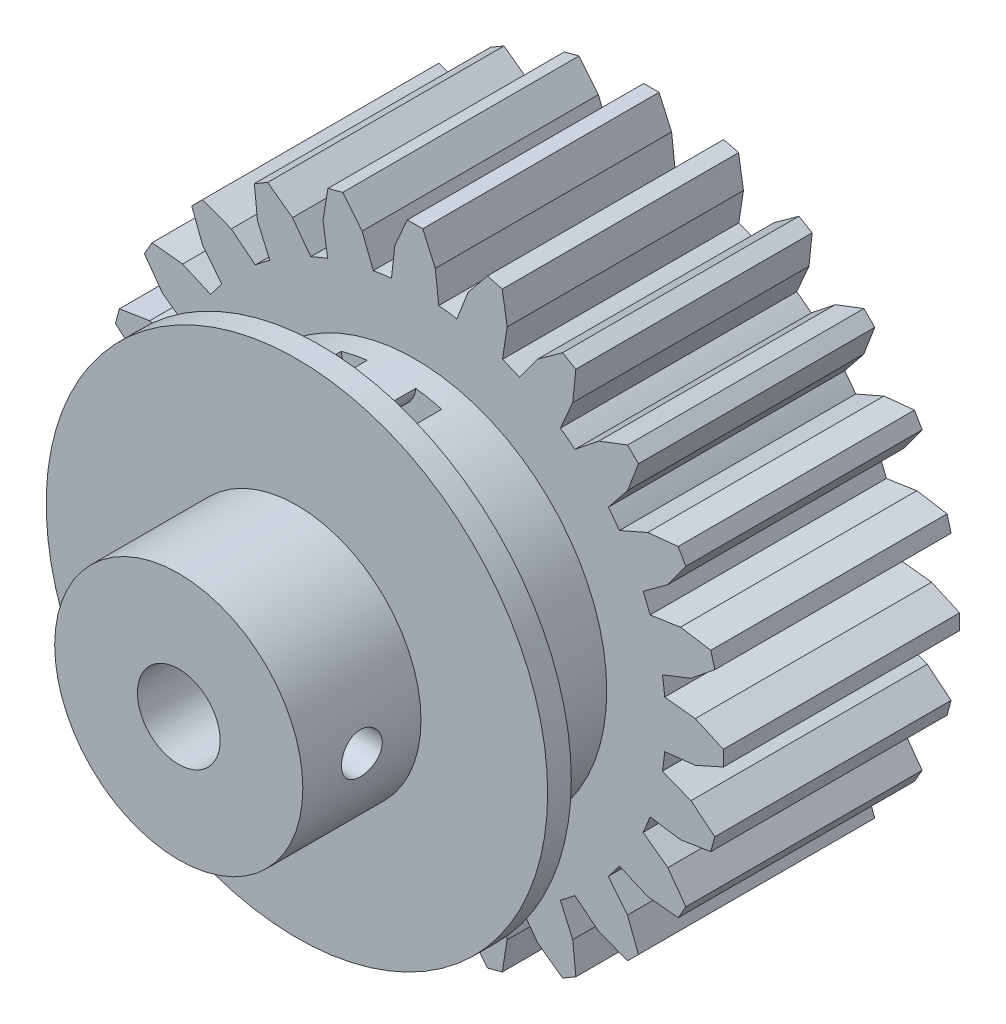
from build123d import *

# Parameters (mm, degrees)
ESQUISSE1_R                  = 3.5
BOSS_EXTRU_1_DEPTH           = 20
ESQUISSE2_R                  = 16.22
ESQUISSE2_R_2                = 3.5
BOSS_EXTRU_2_DEPTH           = 10
ESQUISSE14_R                 = 10.5
ESQUISSE14_R_2               = 3.5
BOSS_EXTRU_9_DEPTH           = 10
BOSS_EXTRU_10_START          = -2
ESQUISSE15_R                 = 21.22
ESQUISSE15_R_2               = 16.22
BOSS_EXTRU_10_DEPTH          = 2
ENL_V_MAT_EXTRU_1_REACH      = 56.412
ENL_V_MAT_EXTRU_1_END_RADIUS = 10.5
ESQUISSE3_R                  = 1.725
ENL_V_START                  = 2
ENL_V_MAT_EXTRU_2_DEPTH      = 4


with BuildPart() as part:
    # Esquisse1 → Boss.-Extru.1 (new body)
    with BuildSketch(Plane.XY):
        with BuildLine():
            Line((-2, 21.125539046), (-1.710180776, 23.709335636))
            Line((-1.710180776, 23.709335636), (-0.65, 26.083365274))
            Line((-0.65, 26.083365274), (0.65, 26.083365274))
            Line((0.65, 26.083365274), (1.710180776, 23.709335636))
            Line((1.710180776, 23.709335636), (2, 21.125539046))
            ThreePointArc((2, 21.125539046), (2.769765799, 21.038459958), (3.535840191, 20.923341849))
            Line((3.535840191, 20.923341849), (4.48451983, 23.344086971))
            Line((4.48451983, 23.344086971), (6.123019906, 25.362828534))
            Line((6.123019906, 25.362828534), (7.37872348, 25.026363775))
            Line((7.37872348, 25.026363775), (7.788335389, 22.45883226))
            Line((7.788335389, 22.45883226), (7.399543496, 19.888065669))
            ThreePointArc((7.399543496, 19.888065669), (8.120542435, 19.60472368), (8.830718716, 19.295253483))
            Line((8.830718716, 19.295253483), (10.373607821, 21.387977356))
            Line((10.373607821, 21.387977356), (12.478766125, 22.913856944))
            Line((12.478766125, 22.913856944), (13.60459915, 22.263856944))
            Line((13.60459915, 22.263856944), (13.335727815, 19.67779658))
            Line((13.335727815, 19.67779658), (12.294820331, 17.295253483))
            ThreePointArc((12.294820331, 17.295253483), (12.917917524, 16.834957881), (13.523798354, 16.352225478))
            Line((13.523798354, 16.352225478), (15.555751582, 17.97431243))
            Line((15.555751582, 17.97431243), (17.984105054, 18.903343869))
            Line((17.984105054, 18.903343869), (18.903343869, 17.984105054))
            Line((18.903343869, 17.984105054), (17.97431243, 15.555751582))
            Line((17.97431243, 15.555751582), (16.352225478, 13.523798354))
            ThreePointArc((16.352225478, 13.523798354), (16.834957881, 12.917917524), (17.295253483, 12.294820331))
            Line((17.295253483, 12.294820331), (19.67779658, 13.335727815))
            Line((19.67779658, 13.335727815), (22.263856944, 13.60459915))
            Line((22.263856944, 13.60459915), (22.913856944, 12.478766125))
            Line((22.913856944, 12.478766125), (21.387977356, 10.373607821))
            Line((21.387977356, 10.373607821), (19.295253483, 8.830718716))
            ThreePointArc((19.295253483, 8.830718716), (19.60472368, 8.120542435), (19.888065669, 7.399543496))
            Line((19.888065669, 7.399543496), (22.45883226, 7.788335389))
            Line((22.45883226, 7.788335389), (25.026363775, 7.37872348))
            Line((25.026363775, 7.37872348), (25.362828534, 6.123019906))
            Line((25.362828534, 6.123019906), (23.344086971, 4.48451983))
            Line((23.344086971, 4.48451983), (20.923341849, 3.535840191))
            ThreePointArc((20.923341849, 3.535840191), (21.038459958, 2.769765799), (21.125539046, 2))
            Line((21.125539046, 2), (23.709335636, 1.710180776))
            Line((23.709335636, 1.710180776), (26.083365274, 0.65))
            Line((26.083365274, 0.65), (26.083365274, -0.65))
            Line((26.083365274, -0.65), (23.709335636, -1.710180776))
            Line((23.709335636, -1.710180776), (21.125539046, -2))
            ThreePointArc((21.125539046, -2), (21.038459958, -2.769765799), (20.923341849, -3.535840191))
            Line((20.923341849, -3.535840191), (23.344086971, -4.48451983))
            Line((23.344086971, -4.48451983), (25.362828534, -6.123019906))
            Line((25.362828534, -6.123019906), (25.026363775, -7.37872348))
            Line((25.026363775, -7.37872348), (22.45883226, -7.788335389))
            Line((22.45883226, -7.788335389), (19.888065669, -7.399543496))
            ThreePointArc((19.888065669, -7.399543496), (19.60472368, -8.120542435), (19.295253483, -8.830718716))
            Line((19.295253483, -8.830718716), (21.387977356, -10.373607821))
            Line((21.387977356, -10.373607821), (22.913856944, -12.478766125))
            Line((22.913856944, -12.478766125), (22.263856944, -13.60459915))
            Line((22.263856944, -13.60459915), (19.67779658, -13.335727815))
            Line((19.67779658, -13.335727815), (17.295253483, -12.294820331))
            ThreePointArc((17.295253483, -12.294820331), (16.834957881, -12.917917524), (16.352225478, -13.523798354))
            Line((16.352225478, -13.523798354), (17.97431243, -15.555751582))
            Line((17.97431243, -15.555751582), (18.903343869, -17.984105054))
            Line((18.903343869, -17.984105054), (17.984105054, -18.903343869))
            Line((17.984105054, -18.903343869), (15.555751582, -17.97431243))
            Line((15.555751582, -17.97431243), (13.523798354, -16.352225478))
            ThreePointArc((13.523798354, -16.352225478), (12.917917524, -16.834957881), (12.294820331, -17.295253483))
            Line((12.294820331, -17.295253483), (13.335727815, -19.67779658))
            Line((13.335727815, -19.67779658), (13.60459915, -22.263856944))
            Line((13.60459915, -22.263856944), (12.478766125, -22.913856944))
            Line((12.478766125, -22.913856944), (10.373607821, -21.387977356))
            Line((10.373607821, -21.387977356), (8.830718716, -19.295253483))
            ThreePointArc((8.830718716, -19.295253483), (8.120542435, -19.60472368), (7.399543496, -19.888065669))
            Line((7.399543496, -19.888065669), (7.788335389, -22.45883226))
            Line((7.788335389, -22.45883226), (7.37872348, -25.026363775))
            Line((7.37872348, -25.026363775), (6.123019906, -25.362828534))
            Line((6.123019906, -25.362828534), (4.48451983, -23.344086971))
            Line((4.48451983, -23.344086971), (3.535840191, -20.923341849))
            ThreePointArc((3.535840191, -20.923341849), (2.769765799, -21.038459958), (2, -21.125539046))
            Line((2, -21.125539046), (1.710180776, -23.709335636))
            Line((1.710180776, -23.709335636), (0.65, -26.083365274))
            Line((0.65, -26.083365274), (-0.65, -26.083365274))
            Line((-0.65, -26.083365274), (-1.710180776, -23.709335636))
            Line((-1.710180776, -23.709335636), (-2, -21.125539046))
            ThreePointArc((-2, -21.125539046), (-2.769765799, -21.038459958), (-3.535840191, -20.923341849))
            Line((-3.535840191, -20.923341849), (-4.48451983, -23.344086971))
            Line((-4.48451983, -23.344086971), (-6.123019906, -25.362828534))
            Line((-6.123019906, -25.362828534), (-7.37872348, -25.026363775))
            Line((-7.37872348, -25.026363775), (-7.788335389, -22.45883226))
            Line((-7.788335389, -22.45883226), (-7.399543496, -19.888065669))
            ThreePointArc((-7.399543496, -19.888065669), (-8.120542435, -19.60472368), (-8.830718716, -19.295253483))
            Line((-8.830718716, -19.295253483), (-10.373607821, -21.387977356))
            Line((-10.373607821, -21.387977356), (-12.478766125, -22.913856944))
            Line((-12.478766125, -22.913856944), (-13.60459915, -22.263856944))
            Line((-13.60459915, -22.263856944), (-13.335727815, -19.67779658))
            Line((-13.335727815, -19.67779658), (-12.294820331, -17.295253483))
            ThreePointArc((-12.294820331, -17.295253483), (-12.917917524, -16.834957881), (-13.523798354, -16.352225478))
            Line((-13.523798354, -16.352225478), (-15.555751582, -17.97431243))
            Line((-15.555751582, -17.97431243), (-17.984105054, -18.903343869))
            Line((-17.984105054, -18.903343869), (-18.903343869, -17.984105054))
            Line((-18.903343869, -17.984105054), (-17.97431243, -15.555751582))
            Line((-17.97431243, -15.555751582), (-16.352225478, -13.523798354))
            ThreePointArc((-16.352225478, -13.523798354), (-16.834957881, -12.917917524), (-17.295253483, -12.294820331))
            Line((-17.295253483, -12.294820331), (-19.67779658, -13.335727815))
            Line((-19.67779658, -13.335727815), (-22.263856944, -13.60459915))
            Line((-22.263856944, -13.60459915), (-22.913856944, -12.478766125))
            Line((-22.913856944, -12.478766125), (-21.387977356, -10.373607821))
            Line((-21.387977356, -10.373607821), (-19.295253483, -8.830718716))
            ThreePointArc((-19.295253483, -8.830718716), (-19.60472368, -8.120542435), (-19.888065669, -7.399543496))
            Line((-19.888065669, -7.399543496), (-22.45883226, -7.788335389))
            Line((-22.45883226, -7.788335389), (-25.026363775, -7.37872348))
            Line((-25.026363775, -7.37872348), (-25.362828534, -6.123019906))
            Line((-25.362828534, -6.123019906), (-23.344086971, -4.48451983))
            Line((-23.344086971, -4.48451983), (-20.923341849, -3.535840191))
            ThreePointArc((-20.923341849, -3.535840191), (-21.038459958, -2.769765799), (-21.125539046, -2))
            Line((-21.125539046, -2), (-23.709335636, -1.710180776))
            Line((-23.709335636, -1.710180776), (-26.083365274, -0.65))
            Line((-26.083365274, -0.65), (-26.083365274, 0.65))
            Line((-26.083365274, 0.65), (-23.709335636, 1.710180776))
            Line((-23.709335636, 1.710180776), (-21.125539046, 2))
            ThreePointArc((-21.125539046, 2), (-21.038459958, 2.769765799), (-20.923341849, 3.535840191))
            Line((-20.923341849, 3.535840191), (-23.344086971, 4.48451983))
            Line((-23.344086971, 4.48451983), (-25.362828534, 6.123019906))
            Line((-25.362828534, 6.123019906), (-25.026363775, 7.37872348))
            Line((-25.026363775, 7.37872348), (-22.45883226, 7.788335389))
            Line((-22.45883226, 7.788335389), (-19.888065669, 7.399543496))
            ThreePointArc((-19.888065669, 7.399543496), (-19.60472368, 8.120542435), (-19.295253483, 8.830718716))
            Line((-19.295253483, 8.830718716), (-21.387977356, 10.373607821))
            Line((-21.387977356, 10.373607821), (-22.913856944, 12.478766125))
            Line((-22.913856944, 12.478766125), (-22.263856944, 13.60459915))
            Line((-22.263856944, 13.60459915), (-19.67779658, 13.335727815))
            Line((-19.67779658, 13.335727815), (-17.295253483, 12.294820331))
            ThreePointArc((-17.295253483, 12.294820331), (-16.834957881, 12.917917524), (-16.352225478, 13.523798354))
            Line((-16.352225478, 13.523798354), (-17.97431243, 15.555751582))
            Line((-17.97431243, 15.555751582), (-18.903343869, 17.984105054))
            Line((-18.903343869, 17.984105054), (-17.984105054, 18.903343869))
            Line((-17.984105054, 18.903343869), (-15.555751582, 17.97431243))
            Line((-15.555751582, 17.97431243), (-13.523798354, 16.352225478))
            ThreePointArc((-13.523798354, 16.352225478), (-12.917917524, 16.834957881), (-12.294820331, 17.295253483))
            Line((-12.294820331, 17.295253483), (-13.335727815, 19.67779658))
            Line((-13.335727815, 19.67779658), (-13.60459915, 22.263856944))
            Line((-13.60459915, 22.263856944), (-12.478766125, 22.913856944))
            Line((-12.478766125, 22.913856944), (-10.373607821, 21.387977356))
            Line((-10.373607821, 21.387977356), (-8.830718716, 19.295253483))
            ThreePointArc((-8.830718716, 19.295253483), (-8.120542435, 19.60472368), (-7.399543496, 19.888065669))
            Line((-7.399543496, 19.888065669), (-7.788335389, 22.45883226))
            Line((-7.788335389, 22.45883226), (-7.37872348, 25.026363775))
            Line((-7.37872348, 25.026363775), (-6.123019906, 25.362828534))
            Line((-6.123019906, 25.362828534), (-4.48451983, 23.344086971))
            Line((-4.48451983, 23.344086971), (-3.535840191, 20.923341849))
            ThreePointArc((-3.535840191, 20.923341849), (-2.769765799, 21.038459958), (-2, 21.125539046))
        make_face()
        Circle(ESQUISSE1_R, mode=Mode.SUBTRACT)
    extrude(amount=BOSS_EXTRU_1_DEPTH)

    # Esquisse2 → Boss.-Extru.2 (add)
    with BuildSketch(Plane.XY.offset(20)):
        Circle(ESQUISSE2_R)
        Circle(ESQUISSE2_R_2, mode=Mode.SUBTRACT)
    extrude(amount=BOSS_EXTRU_2_DEPTH)

    # Esquisse14 → Boss.-Extru.9 (add)
    with BuildSketch(Plane.XY.offset(30)):
        Circle(ESQUISSE14_R)
        Circle(ESQUISSE14_R_2, mode=Mode.SUBTRACT)
    extrude(amount=BOSS_EXTRU_9_DEPTH)

    # Esquisse15 → Boss.-Extru.10 (add)
    with BuildSketch(Plane.XY.offset(30).offset(BOSS_EXTRU_10_START)):
        Circle(ESQUISSE15_R)
        Circle(ESQUISSE15_R_2, mode=Mode.SUBTRACT)
    extrude(amount=BOSS_EXTRU_10_DEPTH)

    # Enlèv. mat.-Extru.1: up to this cylinder (the profile starts inside it)
    enl_v_mat_extru_1_end = Plane(origin=(0, 0, 35), z_dir=(0, 0, -1)) * Cylinder(ENL_V_MAT_EXTRU_1_END_RADIUS, 134.824, mode=Mode.PRIVATE)
    # Esquisse3 → Enlèv. mat.-Extru.1 (cut, up to the surface)
    with BuildSketch(Plane(origin=(0, 0, 0), x_dir=(0, -1, 0), z_dir=(1, 0, 0)), mode=Mode.PRIVATE) as enl_v_mat_extru_1_sk1:
        with Locations(Location((0, -35, 0), (0, 0, 270))):
            Circle(ESQUISSE3_R)
    enl_v_mat_extru_1_tool1 = extrude(enl_v_mat_extru_1_sk1.sketch, amount=ENL_V_MAT_EXTRU_1_REACH, mode=Mode.PRIVATE) & enl_v_mat_extru_1_end
    add(enl_v_mat_extru_1_tool1.solids().sort_by_distance((0, 0, 35))[0], mode=Mode.SUBTRACT)

    # Esquisse16 → Enlèv. mat.-Extru.2 (cut)
    with BuildSketch(Plane.XY.offset(20).offset(ENL_V_START)):
        with BuildLine():
            ThreePointArc((-2.054048319, 16.089415325), (0, 14.161804952), (2.054048319, 16.089415325))
            ThreePointArc((2.054048319, 16.089415325), (3.204868234, 16.132050505), (4.251999967, 15.652760021))
            ThreePointArc((4.251999967, 15.652760021), (0, 11.930330442), (-4.251999967, 15.652760021))
            ThreePointArc((-4.251999967, 15.652760021), (-3.230334801, 16.260239221), (-2.054048319, 16.089415325))
        make_face()
    extrude(amount=ENL_V_MAT_EXTRU_2_DEPTH, mode=Mode.SUBTRACT)


solid = part.part
